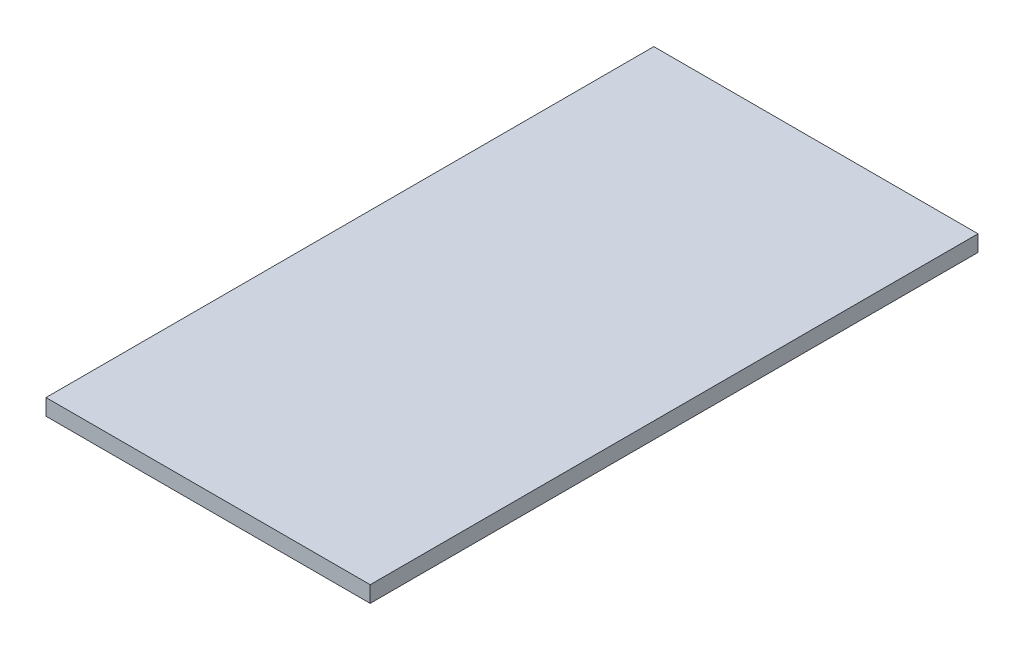
from build123d import *

# Parameters (mm, degrees)
SKETCH1_W           = 80
SKETCH1_H           = 150
BOSS_EXTRUDE1_DEPTH = 4


with BuildPart() as part:
    # Sketch1 → Boss-Extrude1 (new body)
    with BuildSketch(Plane(origin=(0, 0, 0), x_dir=(1, 0, 0), z_dir=(0, 1, 0))):
        Rectangle(SKETCH1_W, SKETCH1_H)
    extrude(amount=BOSS_EXTRUDE1_DEPTH)


solid = part.part
